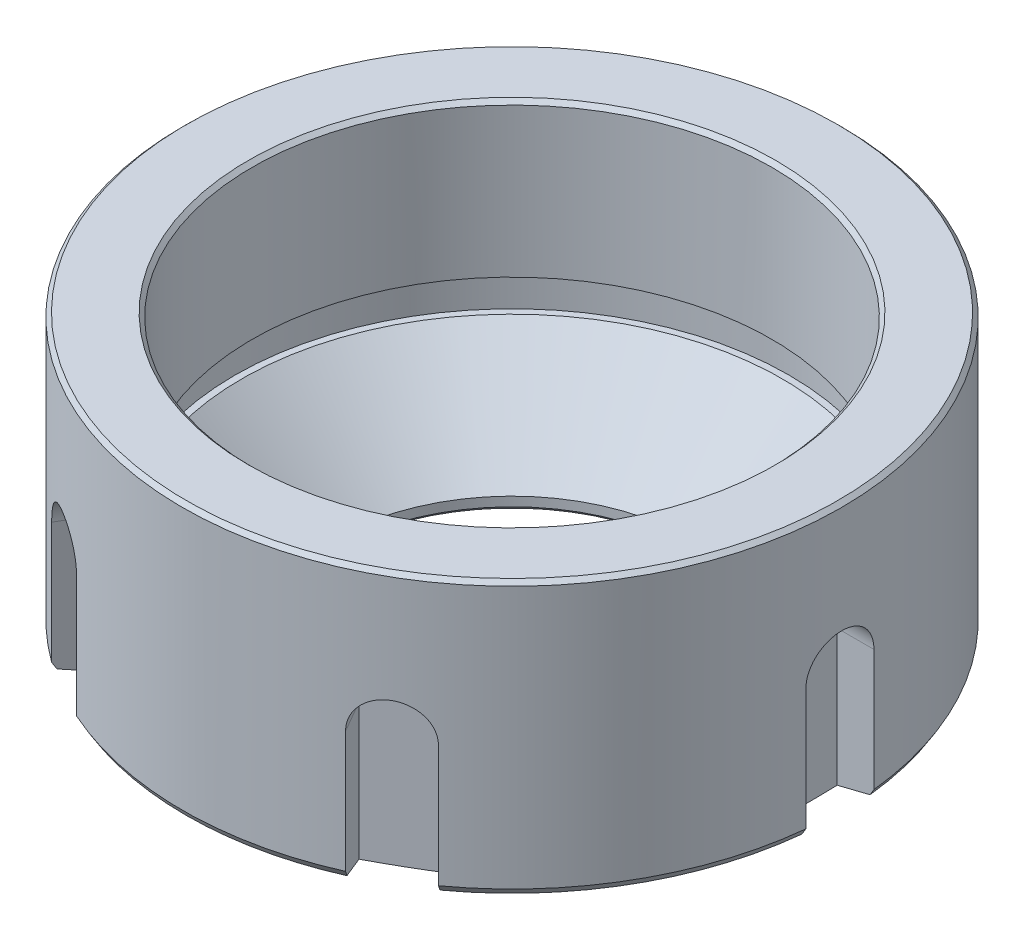
from build123d import *
from OCP.BRepFilletAPI import BRepFilletAPI_MakeChamfer

# Parameters (mm, degrees)
CHAMFER1_SIZE      = 8
CHAMFER1_SIZE2     = 2
CHAMFER2_SIZE      = 0.3
CHAMFER2_SIZE2     = 0.412310563
CUT_EXTRUDE1_DEPTH = 2.92
CIRPATTERN1_COUNT  = 6


with BuildPart() as part:
    # Sketch1 → Revolve1 (revolve)
    with BuildSketch(Plane.XY, mode=Mode.PRIVATE) as revolve1_sk:
        Polygon((19.7, -15), (19.7, -26.6), (21, -26.6), (21, -29.6), (20.5, -29.6), (13.5, -36.6), (13.5, -37.6), (25, -37.6), (25, -15), align=None)
    revolve(revolve1_sk.sketch.rotate(Axis((0, 0, 0), (0, -1, 0)), 90), axis=Axis((0, 0, 0), (0, -1, 0)))

    # Chamfer1
    chamfer1_edges = [part.edges().sort_by_distance(p)[0] for p in [
        (0, -37.6, -25),
    ]]
    chamfer1_side = [part.faces().sort_by_distance(p)[0] for p in [
        (0, -37.6, -14.207106781),
    ]]
    chamfer(chamfer1_edges, length=CHAMFER1_SIZE, length2=CHAMFER1_SIZE2, reference=chamfer1_side[0])

    # Chamfer2: one chamfer whose edges measure the first distance from different faces: ONE call of the kernel's chamfer builder (chamfer() names one face for all edges)
    chamfer2_edges_1 = [part.edges().sort_by_distance(p)[0] for p in [
        (0, -35.6, -25),
    ]]
    chamfer2_side_1 = [part.faces().sort_by_distance(p)[0] for p in [
        (0, -36.6, -21),
    ]]
    chamfer2_edges_2 = [part.edges().sort_by_distance(p)[0] for p in [
        (0, -37.6, -13.5),
        (0, -15, -25),
        (0, -15, -19.7),
    ]]
    chamfer2 = BRepFilletAPI_MakeChamfer(part.part.solid().wrapped)
    for e in chamfer2_edges_1:
        chamfer2.Add(CHAMFER2_SIZE, CHAMFER2_SIZE2, e.wrapped, chamfer2_side_1[0].wrapped)  # the first distance lies on this face
    for e in chamfer2_edges_2:
        chamfer2.Add(CHAMFER2_SIZE, e.wrapped)
    add(Compound.cast(chamfer2.Shape()), mode=Mode.REPLACE)

    # Sketch4 → Cut-Extrude1 (cut)
    with BuildSketch(Plane.ZY.offset(25)):
        with BuildLine():
            Line((-2.58, -37.6), (-2.58, -25.98))
            ThreePointArc((-2.58, -25.98), (0, -23.4), (2.58, -25.98))
            Line((2.58, -25.98), (2.58, -37.6))
            ThreePointArc((2.58, -37.6), (0, -40.18), (-2.58, -37.6))
        make_face()
    cut_extrude1 = extrude(amount=-CUT_EXTRUDE1_DEPTH, mode=Mode.SUBTRACT)

    # CirPattern1: Cut-Extrude1 ×6 about axis
    cirpattern1_axis = Axis((0, 0, 0), (0, 1, 0))
    for i in range(1, CIRPATTERN1_COUNT):
        add(cut_extrude1.rotate(cirpattern1_axis, i * 360 / CIRPATTERN1_COUNT), mode=Mode.SUBTRACT)


solid = part.part
